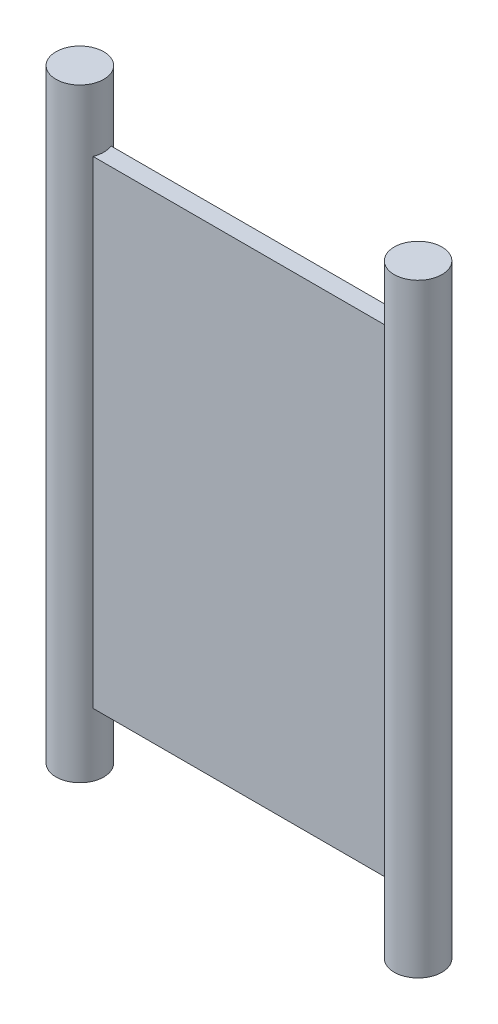
from build123d import *

# Parameters (mm, degrees)
SKETCH1_W           = 18.75
SKETCH1_H           = 1
BOSS_EXTRUDE1_DEPTH = 26.5
SKETCH2_R           = 1.325
BOSS_EXTRUDE2_DEPTH = 16.75


with BuildPart() as part:
    # Sketch1 → Boss-Extrude1 (new body)
    with BuildSketch(Plane(origin=(0, 0, 0), x_dir=(1, 0, 0), z_dir=(0, 1, 0))):
        Rectangle(SKETCH1_W, SKETCH1_H)
    extrude(amount=BOSS_EXTRUDE1_DEPTH)

    # Sketch2 → Boss-Extrude2 (add, symmetric)
    with BuildSketch(Plane(origin=(0, 13.25, 0), x_dir=(1, 0, 0), z_dir=(0, 1, 0))):
        with Locations(Location((-9.375, 0, 0), (0, 0, 270))):
            Circle(SKETCH2_R)
        with Locations(Location((9.375, 0, 0), (0, 0, 270))):
            Circle(SKETCH2_R)
    extrude(amount=BOSS_EXTRUDE2_DEPTH, both=True)


solid = part.part
